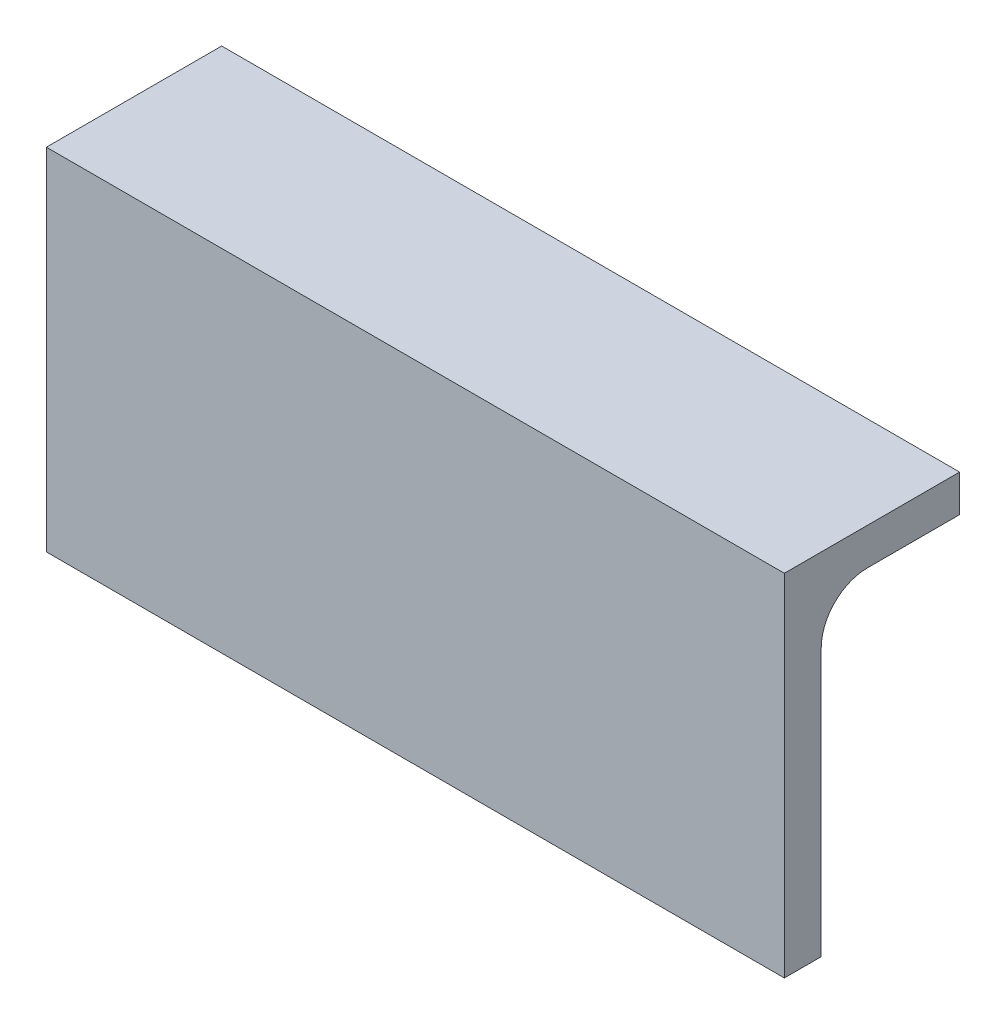
from build123d import *

# Parameters (mm, degrees)
SKETCH4_W           = 32
SKETCH4_H           = 16
BOSS_EXTRUDE3_DEPTH = 1.6
SKETCH5_W           = 32
SKETCH5_H           = 2.4
BOSS_EXTRUDE4_DEPTH = 6
SKETCH6_W           = 32
SKETCH6_H           = 7.6
SKETCH6_W_2         = 30.4
SKETCH6_H_2         = 6
BOSS_EXTRUDE5_DEPTH = 4.8
SKETCH7_W           = 12
SKETCH7_H           = 0.8
CUT_EXTRUDE1_DEPTH  = 4.8
SKETCH8_W           = 26
SKETCH8_H           = 0.8
BOSS_EXTRUDE6_DEPTH = 12
SKETCH9_W           = 0.8
SKETCH9_H           = 12.8
BOSS_EXTRUDE7_DEPTH = 4.8
SKETCH10_W          = 74.676808058
SKETCH10_H          = 45.618872406
CUT_EXTRUDE2_DEPTH  = 5.6
FILLET1_R           = 2


with BuildPart() as part:
    # Sketch4 → Boss-Extrude3 (new body)
    with BuildSketch(Plane.XY):
        with Locations((16, -8)):
            Rectangle(SKETCH4_W, SKETCH4_H)
    extrude(amount=BOSS_EXTRUDE3_DEPTH)

    # Sketch5 → Boss-Extrude4 (add)
    with BuildSketch(Plane(origin=(0, 0, 0), x_dir=(-1, 0, 0), z_dir=(0, 0, -1))):
        with Locations((-16, -1.2)):
            Rectangle(SKETCH5_W, SKETCH5_H)
    extrude(amount=BOSS_EXTRUDE4_DEPTH)

    # Sketch6 → Boss-Extrude5 (add)
    with BuildSketch(Plane(origin=(0, 0, 0), x_dir=(1, 0, 0), z_dir=(0, 1, 0))):
        with Locations((16, 2.2)):
            Rectangle(SKETCH6_W, SKETCH6_H)
        with Locations((16, 2.2)):
            Rectangle(SKETCH6_W_2, SKETCH6_H_2, mode=Mode.SUBTRACT)
    extrude(amount=BOSS_EXTRUDE5_DEPTH)

    # Sketch7 → Cut-Extrude1 (cut)
    with BuildSketch(Plane(origin=(0, 4.8, 0), x_dir=(1, 0, 0), z_dir=(0, 1, 0))):
        with Locations((16, -1.2)):
            Rectangle(SKETCH7_W, SKETCH7_H)
    extrude(amount=-CUT_EXTRUDE1_DEPTH, mode=Mode.SUBTRACT)

    # Sketch8 → Boss-Extrude6 (add)
    with BuildSketch(Plane.XY.offset(1.6)):
        with Locations((23, -0.4)):
            Rectangle(SKETCH8_W, SKETCH8_H)
    extrude(amount=BOSS_EXTRUDE6_DEPTH)

    # Sketch9 → Boss-Extrude7 (add)
    with BuildSketch(Plane(origin=(0, 0, 0), x_dir=(1, 0, 0), z_dir=(0, 1, 0))):
        with Locations((10.4, -7.2)):
            Rectangle(SKETCH9_W, SKETCH9_H)
        with Locations((35.6, -7.2)):
            Rectangle(SKETCH9_W, SKETCH9_H)
    extrude(amount=BOSS_EXTRUDE7_DEPTH)

    # Sketch10 → Cut-Extrude2 (cut)
    with BuildSketch(Plane(origin=(0, 4.8, 0), x_dir=(1, 0, 0), z_dir=(0, 1, 0))):
        with Locations((31.433625096, -2.501503002)):
            Rectangle(SKETCH10_W, SKETCH10_H)
    extrude(amount=-CUT_EXTRUDE2_DEPTH, mode=Mode.SUBTRACT)

    # Fillet1
    fillet1_edges = [part.edges().sort_by_distance(p)[0] for p in [
        (16, -2.4, 0),
    ]]
    fillet(fillet1_edges, radius=FILLET1_R)


solid = part.part
